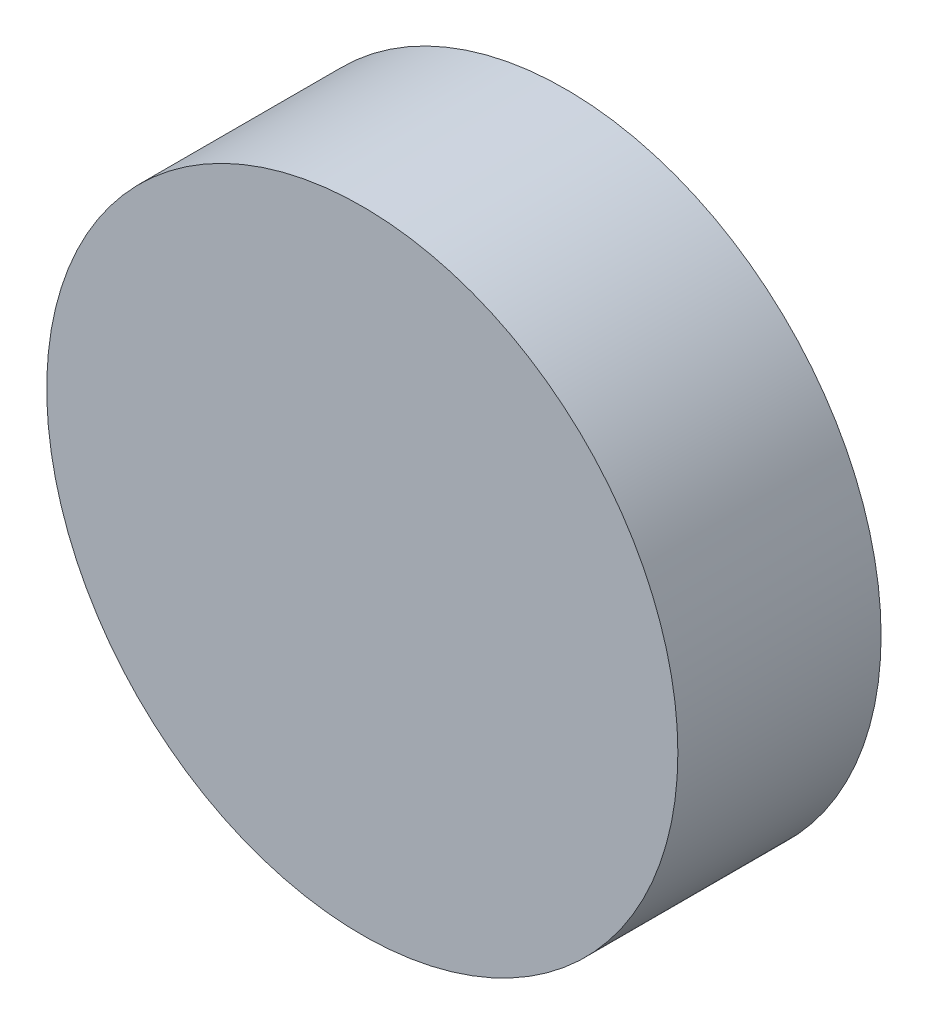
from build123d import *

# Parameters (mm, degrees)
SKETCH1_R           = 63.5
BOSS_EXTRUDE1_DEPTH = 40.894


with BuildPart() as part:
    # Sketch1 → Boss-Extrude1 (new body)
    with BuildSketch(Plane.XY):
        Circle(SKETCH1_R)
    extrude(amount=-BOSS_EXTRUDE1_DEPTH)


solid = part.part
